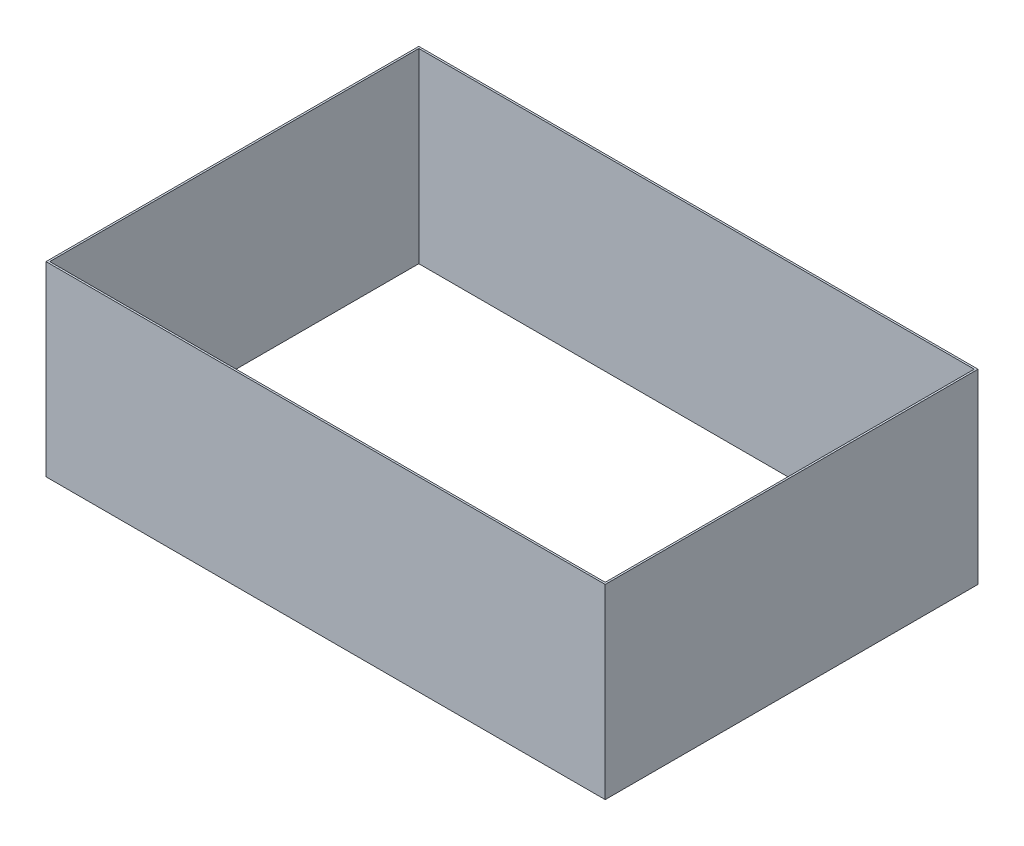
from build123d import *

# Parameters (mm, degrees)
SKETCH_1_W      = 300
SKETCH_1_H      = 200
SKETCH_1_W_2    = 298
SKETCH_1_H_2    = 198
EXTRUDE_1_DEPTH = 100


with BuildPart() as part:
    # Эскиз1 → Вытянуть-Тонкостенный1 (new body)
    with BuildSketch(Plane(origin=(0, 0, 0), x_dir=(1, 0, 0), z_dir=(0, 1, 0))):
        Rectangle(SKETCH_1_W, SKETCH_1_H)
        Rectangle(SKETCH_1_W_2, SKETCH_1_H_2, mode=Mode.SUBTRACT)
    extrude(amount=EXTRUDE_1_DEPTH)


solid = part.part
